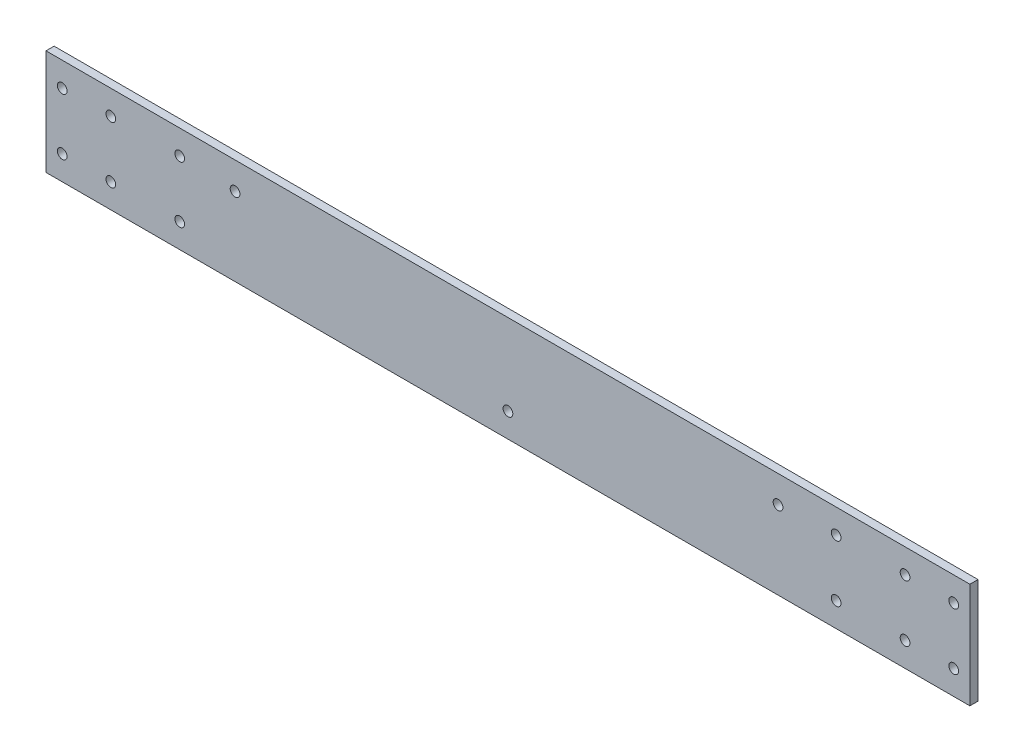
from build123d import *

# Parameters (mm, degrees)
SKETCH_1_W          = 1140
SKETCH_1_H          = 130
SKETCH_1_R          = 6
EXTRUDE_1_DEPTH     = 10
SKETCH_2_R          = 6
CUT_EXTRUDE_1_DEPTH = 574.781317228
SKETCH_3_R          = 6
CUT_EXTRUDE_2_DEPTH = 574.781317228
SKETCH_4_R          = 6
CUT_EXTRUDE_3_DEPTH = 574.781317228


with BuildPart() as part:
    # 草图1 → 凸台-拉伸1 (new body)
    with BuildSketch(Plane.XY):
        Rectangle(SKETCH_1_W, SKETCH_1_H)
        with Locations((-550, 35)):
            Circle(SKETCH_1_R, mode=Mode.SUBTRACT)
        with Locations((-490, 35)):
            Circle(SKETCH_1_R, mode=Mode.SUBTRACT)
        with Locations((-405, 35)):
            Circle(SKETCH_1_R, mode=Mode.SUBTRACT)
        with Locations((-550, -35)):
            Circle(SKETCH_1_R, mode=Mode.SUBTRACT)
        with Locations((-490, -35)):
            Circle(SKETCH_1_R, mode=Mode.SUBTRACT)
        with Locations((-405, -35)):
            Circle(SKETCH_1_R, mode=Mode.SUBTRACT)
        with Locations(Location((405, -35, 0), (0, 0, 180))):
            Circle(SKETCH_1_R, mode=Mode.SUBTRACT)
        with Locations(Location((490, -35, 0), (0, 0, 180))):
            Circle(SKETCH_1_R, mode=Mode.SUBTRACT)
        with Locations(Location((550, -35, 0), (0, 0, 180))):
            Circle(SKETCH_1_R, mode=Mode.SUBTRACT)
        with Locations(Location((405, 35, 0), (0, 0, 180))):
            Circle(SKETCH_1_R, mode=Mode.SUBTRACT)
        with Locations(Location((490, 35, 0), (0, 0, 180))):
            Circle(SKETCH_1_R, mode=Mode.SUBTRACT)
        with Locations(Location((550, 35, 0), (0, 0, 180))):
            Circle(SKETCH_1_R, mode=Mode.SUBTRACT)
    extrude(amount=EXTRUDE_1_DEPTH)

    # 草图2 → 切除-拉伸1 (cut, through all)
    with BuildSketch(Plane.XY.offset(10)):
        with Locations((0, -35)):
            Circle(SKETCH_2_R)
    extrude(amount=-CUT_EXTRUDE_1_DEPTH, mode=Mode.SUBTRACT)

    # 草图3 → 切除-拉伸2 (cut, through all)
    with BuildSketch(Plane.XY.offset(10)):
        with Locations((333.277993355, 31.467302422)):
            Circle(SKETCH_3_R)
    extrude(amount=-CUT_EXTRUDE_2_DEPTH, mode=Mode.SUBTRACT)

    # 草图4 → 切除-拉伸3 (cut, through all)
    with BuildSketch(Plane.XY.offset(10)):
        with Locations((-336.722006645, 31.467302422)):
            Circle(SKETCH_4_R)
    extrude(amount=-CUT_EXTRUDE_3_DEPTH, mode=Mode.SUBTRACT)


solid = part.part
